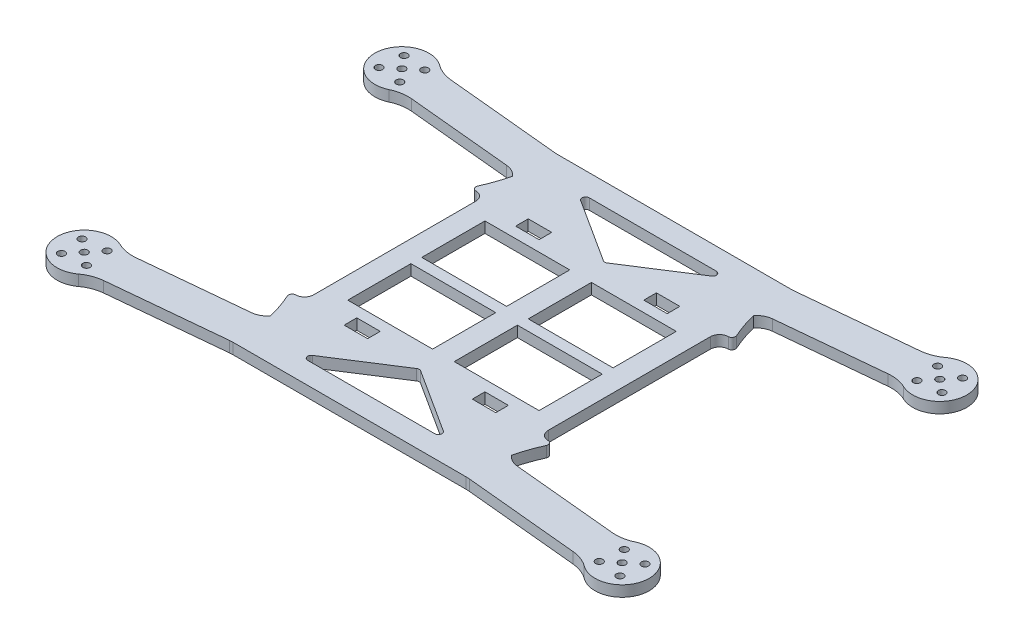
from build123d import *

# Parameters (mm, degrees)
SKETCH1_R           = 1
SKETCH1_W           = 23.5
SKETCH1_H           = 17.5
SKETCH1_W_2         = 6.5
SKETCH1_H_2         = 3.5
BOSS_EXTRUDE1_DEPTH = 1.5


with BuildPart() as part:
    # Sketch1 → Boss-Extrude1 (new, symmetric)
    with BuildSketch(Plane(origin=(0, 0, 0), x_dir=(1, 0, 0), z_dir=(0, 1, 0))):
        with BuildLine():
            Line((33.208457525, 45.046038016), (65.04658306, 48.11170082))
            ThreePointArc((65.04658306, 48.11170082), (67.67262656, 48.730173936), (70.037768086, 50.028141202))
            ThreePointArc((70.037768086, 50.028141202), (81.965379016, 44.719802857), (71.271715852, 37.230348498))
            ThreePointArc((71.271715852, 37.230348498), (68.703419373, 38.05229444), (66.008879463, 38.158108479))
            Line((66.008879463, 38.158108479), (36.823007283, 35.347828626))
            ThreePointArc((36.823007283, 35.347828626), (34.924055904, 34.769058544), (33.4, 33.496956053))
            ThreePointArc((33.4, 33.496956053), (34.472450841, 29.872901682), (35.862619587, 26.358452685))
            ThreePointArc((35.862619587, 26.358452685), (35.793150506, 25.411965218), (34.964285714, 24.949744885))
            ThreePointArc((34.964285714, 24.949744885), (33.219650917, 24.205094625), (32.5, 22.45))
            Line((32.5, 22.45), (32.5, -22.45))
            ThreePointArc((32.5, -22.45), (33.219650917, -24.205094625), (34.964285714, -24.949744885))
            ThreePointArc((34.964285714, -24.949744885), (35.793150506, -25.411965218), (35.862619587, -26.358452685))
            ThreePointArc((35.862619587, -26.358452685), (34.472450841, -29.872901682), (33.4, -33.496956053))
            ThreePointArc((33.4, -33.496956053), (34.924055904, -34.769058544), (36.823007283, -35.347828626))
            Line((36.823007283, -35.347828626), (66.008879463, -38.158108479))
            ThreePointArc((66.008879463, -38.158108479), (68.703419373, -38.05229444), (71.271715852, -37.230348498))
            ThreePointArc((71.271715852, -37.230348498), (81.965379016, -44.719802857), (70.037768086, -50.028141202))
            ThreePointArc((70.037768086, -50.028141202), (67.67262656, -48.730173936), (65.04658306, -48.11170082))
            Line((65.04658306, -48.11170082), (33.208457525, -45.046038016))
            ThreePointArc((33.208457525, -45.046038016), (32.729781285, -45.011516135), (32.25, -45))
            Line((32.25, -45), (-32.25, -45))
            ThreePointArc((-32.25, -45), (-32.729781285, -45.011516135), (-33.208457525, -45.046038016))
            Line((-33.208457525, -45.046038016), (-65.04658306, -48.11170082))
            ThreePointArc((-65.04658306, -48.11170082), (-67.67262656, -48.730173936), (-70.037768086, -50.028141202))
            ThreePointArc((-70.037768086, -50.028141202), (-81.965379016, -44.719802857), (-71.271715852, -37.230348498))
            ThreePointArc((-71.271715852, -37.230348498), (-68.703419373, -38.05229444), (-66.008879463, -38.158108479))
            Line((-66.008879463, -38.158108479), (-36.823007283, -35.347828626))
            ThreePointArc((-36.823007283, -35.347828626), (-34.924055904, -34.769058544), (-33.4, -33.496956053))
            ThreePointArc((-33.4, -33.496956053), (-34.472450841, -29.872901682), (-35.862619587, -26.358452685))
            ThreePointArc((-35.862619587, -26.358452685), (-35.793150506, -25.411965218), (-34.964285714, -24.949744885))
            ThreePointArc((-34.964285714, -24.949744885), (-33.219650917, -24.205094625), (-32.5, -22.45))
            Line((-32.5, -22.45), (-32.5, 22.45))
            ThreePointArc((-32.5, 22.45), (-33.219650917, 24.205094625), (-34.964285714, 24.949744885))
            ThreePointArc((-34.964285714, 24.949744885), (-35.793150506, 25.411965218), (-35.862619587, 26.358452685))
            ThreePointArc((-35.862619587, 26.358452685), (-34.472450841, 29.872901682), (-33.4, 33.496956053))
            ThreePointArc((-33.4, 33.496956053), (-34.924055904, 34.769058544), (-36.823007283, 35.347828626))
            Line((-36.823007283, 35.347828626), (-66.008879463, 38.158108479))
            ThreePointArc((-66.008879463, 38.158108479), (-68.703419373, 38.05229444), (-71.271715852, 37.230348498))
            ThreePointArc((-71.271715852, 37.230348498), (-81.965379016, 44.719802857), (-70.037768086, 50.028141202))
            ThreePointArc((-70.037768086, 50.028141202), (-67.67262656, 48.730173936), (-65.04658306, 48.11170082))
            Line((-65.04658306, 48.11170082), (-33.208457525, 45.046038016))
            ThreePointArc((-33.208457525, 45.046038016), (-32.729781285, 45.011516135), (-32.25, 45))
            Line((-32.25, 45), (32.25, 45))
            ThreePointArc((32.25, 45), (32.729781285, 45.011516135), (33.208457525, 45.046038016))
        make_face()
        with Locations(Location((74.5, 44, 0), (0, 0, 270))):
            Circle(SKETCH1_R, mode=Mode.SUBTRACT)
        with Locations(Location((71.027689375, 46.862351991, 0), (0, 0, 270))):
            Circle(SKETCH1_R, mode=Mode.SUBTRACT)
        with Locations(Location((77.362351991, 47.472310625, 0), (0, 0, 270))):
            Circle(SKETCH1_R, mode=Mode.SUBTRACT)
        with Locations(Location((77.972310625, 41.137648009, 0), (0, 0, 270))):
            Circle(SKETCH1_R, mode=Mode.SUBTRACT)
        with Locations(Location((71.637648009, 40.527689375, 0), (0, 0, 270))):
            Circle(SKETCH1_R, mode=Mode.SUBTRACT)
        with Locations(Location((-71.637648009, 40.527689375, 0), (0, 0, 90))):
            Circle(SKETCH1_R, mode=Mode.SUBTRACT)
        with Locations(Location((-77.972310625, 41.137648009, 0), (0, 0, 90))):
            Circle(SKETCH1_R, mode=Mode.SUBTRACT)
        with Locations(Location((-77.362351991, 47.472310625, 0), (0, 0, 90))):
            Circle(SKETCH1_R, mode=Mode.SUBTRACT)
        with Locations(Location((-71.027689375, 46.862351991, 0), (0, 0, 90))):
            Circle(SKETCH1_R, mode=Mode.SUBTRACT)
        with Locations(Location((-74.5, 44, 0), (0, 0, 90))):
            Circle(SKETCH1_R, mode=Mode.SUBTRACT)
        with Locations(Location((-74.5, -44, 0), (0, 0, 270))):
            Circle(SKETCH1_R, mode=Mode.SUBTRACT)
        with Locations(Location((-71.027689375, -46.862351991, 0), (0, 0, 270))):
            Circle(SKETCH1_R, mode=Mode.SUBTRACT)
        with Locations(Location((-77.362351991, -47.472310625, 0), (0, 0, 270))):
            Circle(SKETCH1_R, mode=Mode.SUBTRACT)
        with Locations(Location((-77.972310625, -41.137648009, 0), (0, 0, 270))):
            Circle(SKETCH1_R, mode=Mode.SUBTRACT)
        with Locations(Location((-71.637648009, -40.527689375, 0), (0, 0, 270))):
            Circle(SKETCH1_R, mode=Mode.SUBTRACT)
        with Locations(Location((71.637648009, -40.527689375, 0), (0, 0, 90))):
            Circle(SKETCH1_R, mode=Mode.SUBTRACT)
        with Locations(Location((77.972310625, -41.137648009, 0), (0, 0, 90))):
            Circle(SKETCH1_R, mode=Mode.SUBTRACT)
        with Locations(Location((77.362351991, -47.472310625, 0), (0, 0, 90))):
            Circle(SKETCH1_R, mode=Mode.SUBTRACT)
        with Locations(Location((71.027689375, -46.862351991, 0), (0, 0, 90))):
            Circle(SKETCH1_R, mode=Mode.SUBTRACT)
        with Locations(Location((74.5, -44, 0), (0, 0, 90))):
            Circle(SKETCH1_R, mode=Mode.SUBTRACT)
        with BuildLine():
            Line((0.54024032, 25.859490032), (18.14024032, 37.158489218))
            ThreePointArc((18.14024032, 37.158489218), (18.559559999, 38.28150419), (17.6, 39))
            Line((17.6, 39), (-17.6, 39))
            ThreePointArc((-17.6, 39), (-18.559559999, 38.28150419), (-18.14024032, 37.158489218))
            Line((-18.14024032, 37.158489218), (-0.54024032, 25.859490032))
            ThreePointArc((-0.54024032, 25.859490032), (0, 25.701000814), (0.54024032, 25.859490032))
        make_face(mode=Mode.SUBTRACT)
        with Locations((14.75, 10.25)):
            Rectangle(SKETCH1_W, SKETCH1_H, mode=Mode.SUBTRACT)
        with Locations((17.75, 23.75)):
            Rectangle(SKETCH1_W_2, SKETCH1_H_2, mode=Mode.SUBTRACT)
        with Locations((-17.75, 23.75)):
            Rectangle(SKETCH1_W_2, SKETCH1_H_2, mode=Mode.SUBTRACT)
        with Locations((-14.75, 10.25)):
            Rectangle(SKETCH1_W, SKETCH1_H, mode=Mode.SUBTRACT)
        with Locations((-14.75, -10.25)):
            Rectangle(SKETCH1_W, SKETCH1_H, mode=Mode.SUBTRACT)
        with Locations((-17.75, -23.75)):
            Rectangle(SKETCH1_W_2, SKETCH1_H_2, mode=Mode.SUBTRACT)
        with BuildLine():
            Line((-18.14024032, -37.158489218), (-0.54024032, -25.859490032))
            ThreePointArc((-0.54024032, -25.859490032), (0, -25.701000814), (0.54024032, -25.859490032))
            Line((0.54024032, -25.859490032), (18.14024032, -37.158489218))
            ThreePointArc((18.14024032, -37.158489218), (18.559559999, -38.28150419), (17.6, -39))
            Line((17.6, -39), (-17.6, -39))
            ThreePointArc((-17.6, -39), (-18.559559999, -38.28150419), (-18.14024032, -37.158489218))
        make_face(mode=Mode.SUBTRACT)
        with Locations((17.75, -23.75)):
            Rectangle(SKETCH1_W_2, SKETCH1_H_2, mode=Mode.SUBTRACT)
        with Locations((14.75, -10.25)):
            Rectangle(SKETCH1_W, SKETCH1_H, mode=Mode.SUBTRACT)
    extrude(amount=BOSS_EXTRUDE1_DEPTH, both=True)


solid = part.part
